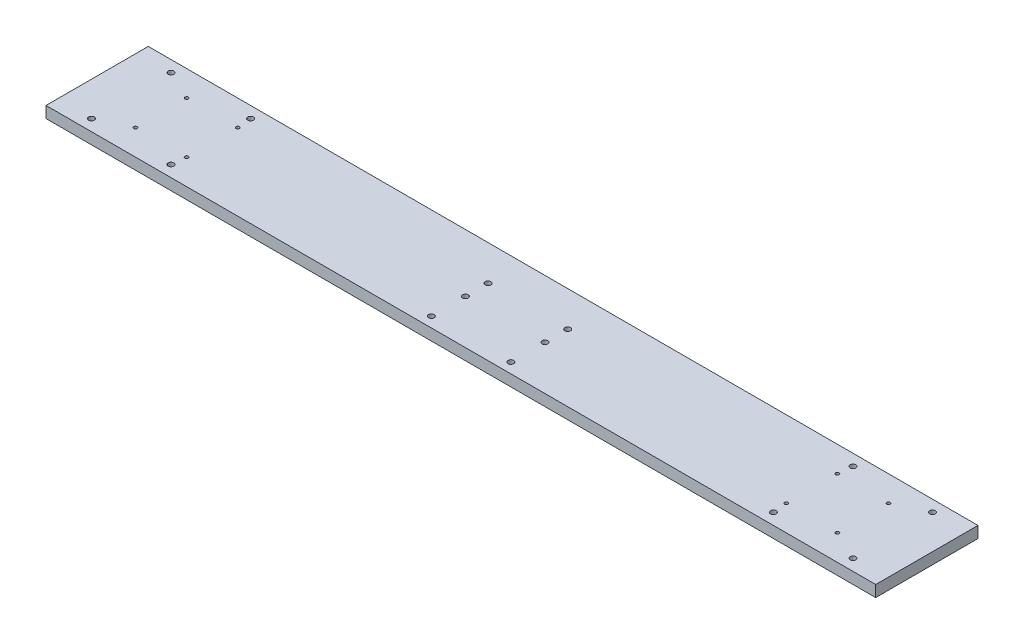
from build123d import *

# Parameters (mm, degrees)
SKETCH_1_W          = 240
SKETCH_1_H          = 90
EXTRUDE_1_DEPTH     = 4
SKETCH_2_W          = 170
SKETCH_2_H          = 90
EXTRUDE_2_DEPTH     = 6
SKETCH_4_R          = 2.5
CUT_EXTRUDE_5_DEPTH = 257.515106768
SKETCH_5_W          = 90
SKETCH_5_H          = 10
EXTRUDE_3_DEPTH     = 250
SKETCH_6_W          = 90
SKETCH_6_H          = 10
EXTRUDE_4_DEPTH     = 250
SKETCH_7_R          = 1.5
CUT_EXTRUDE_7_DEPTH = 520
SKETCH_8_R          = 3.5
CUT_EXTRUDE_8_DEPTH = 5
SKETCH_11_W         = 90
SKETCH_11_H         = 10
EXTRUDE_5_DEPTH     = 30
SKETCH_12_W         = 90
SKETCH_12_H         = 10
EXTRUDE_6_DEPTH     = 30
SKETCH_14_R         = 2.5
CUT_EXTRUDE_9_DEPTH = 30


with BuildPart() as part:
    # 草图1 → 凸台-拉伸1 (new body)
    with BuildSketch(Plane(origin=(0, 0, 0), x_dir=(1, 0, 0), z_dir=(0, 1, 0))):
        with Locations((120, -45)):
            Rectangle(SKETCH_1_W, SKETCH_1_H)
    extrude(amount=EXTRUDE_1_DEPTH)

    # 草图2 → 凸台-拉伸2 (add)
    with BuildSketch(Plane(origin=(0, 4, 0), x_dir=(1, 0, 0), z_dir=(0, 1, 0))):
        with Locations((120, -45)):
            Rectangle(SKETCH_2_W, SKETCH_2_H)
    extrude(amount=EXTRUDE_2_DEPTH)

    # 草图4 → 切除-拉伸5 (cut, through all)
    with BuildSketch(Plane.XZ):
        with Locations(Location((85, 81, 0), (0, 0, 270))):
            Circle(SKETCH_4_R)
        with Locations(Location((155, 81, 0), (0, 0, 270))):
            Circle(SKETCH_4_R)
        with Locations(Location((85, 31, 0), (0, 0, 270))):
            Circle(SKETCH_4_R)
        with Locations(Location((155, 31, 0), (0, 0, 270))):
            Circle(SKETCH_4_R)
        with Locations(Location((85, 51, 0), (0, 0, 270))):
            Circle(SKETCH_4_R)
        with Locations(Location((155, 51, 0), (0, 0, 270))):
            Circle(SKETCH_4_R)
    extrude(amount=-CUT_EXTRUDE_5_DEPTH, mode=Mode.SUBTRACT)

    # 草图5 → 凸台-拉伸3 (add)
    with BuildSketch(Plane(origin=(205, 0, 0), x_dir=(0, 0, -1), z_dir=(1, 0, 0))):
        with Locations((-45, 5)):
            Rectangle(SKETCH_5_W, SKETCH_5_H)
    extrude(amount=EXTRUDE_3_DEPTH)

    # 草图6 → 凸台-拉伸4 (add)
    with BuildSketch(Plane.ZY.offset(-35)):
        with Locations((45, 5)):
            Rectangle(SKETCH_6_W, SKETCH_6_H)
    extrude(amount=EXTRUDE_4_DEPTH)

    # 草图7 → 切除-拉伸7 (cut)
    with BuildSketch(Plane(origin=(0, 10, 0), x_dir=(1, 0, 0), z_dir=(0, 1, 0))):
        with Locations(Location((-188.76, -22.5, 0), (0, 0, 270))):
            Circle(SKETCH_7_R)
        with Locations(Location((-188.76, -67.5, 0), (0, 0, 270))):
            Circle(SKETCH_7_R)
        with Locations(Location((-143.76, -67.5, 0), (0, 0, 270))):
            Circle(SKETCH_7_R)
        with Locations(Location((-143.76, -22.5, 0), (0, 0, 270))):
            Circle(SKETCH_7_R)
        with Locations(Location((383.76, -22.5, 0), (0, 0, 270))):
            Circle(SKETCH_7_R)
        with Locations(Location((383.76, -67.5, 0), (0, 0, 270))):
            Circle(SKETCH_7_R)
        with Locations(Location((428.76, -67.5, 0), (0, 0, 270))):
            Circle(SKETCH_7_R)
        with Locations(Location((428.76, -22.5, 0), (0, 0, 270))):
            Circle(SKETCH_7_R)
    extrude(amount=-CUT_EXTRUDE_7_DEPTH, mode=Mode.SUBTRACT)

    # 草图8 → 切除-拉伸8 (cut)
    with BuildSketch(Plane.XZ):
        with Locations(Location((-188.76, 67.5, 0), (0, 0, 270))):
            Circle(SKETCH_8_R)
        with Locations(Location((-143.76, 67.5, 0), (0, 0, 270))):
            Circle(SKETCH_8_R)
        with Locations(Location((-143.76, 22.5, 0), (0, 0, 270))):
            Circle(SKETCH_8_R)
        with Locations(Location((-188.76, 22.5, 0), (0, 0, 270))):
            Circle(SKETCH_8_R)
        with Locations(Location((383.76, 67.5, 0), (0, 0, 270))):
            Circle(SKETCH_8_R)
        with Locations(Location((428.76, 67.5, 0), (0, 0, 270))):
            Circle(SKETCH_8_R)
        with Locations(Location((383.76, 22.5, 0), (0, 0, 270))):
            Circle(SKETCH_8_R)
        with Locations(Location((428.76, 22.5, 0), (0, 0, 270))):
            Circle(SKETCH_8_R)
    extrude(amount=-CUT_EXTRUDE_8_DEPTH, mode=Mode.SUBTRACT)

    # 草图11 → 凸台-拉伸5 (add)
    with BuildSketch(Plane.ZY.offset(215)):
        with Locations((45, 5)):
            Rectangle(SKETCH_11_W, SKETCH_11_H)
    extrude(amount=EXTRUDE_5_DEPTH)

    # 草图12 → 凸台-拉伸6 (add)
    with BuildSketch(Plane(origin=(455, 0, 0), x_dir=(0, 0, -1), z_dir=(1, 0, 0))):
        with Locations((-45, 5)):
            Rectangle(SKETCH_12_W, SKETCH_12_H)
    extrude(amount=EXTRUDE_6_DEPTH)

    # 草图14 → 切除-拉伸9 (cut)
    with BuildSketch(Plane(origin=(0, 10, 0), x_dir=(1, 0, 0), z_dir=(0, 1, 0))):
        with Locations(Location((-215, -10, 0), (0, 0, 270))):
            Circle(SKETCH_14_R)
        with Locations(Location((-215, -80, 0), (0, 0, 270))):
            Circle(SKETCH_14_R)
        with Locations(Location((-145, -80, 0), (0, 0, 270))):
            Circle(SKETCH_14_R)
        with Locations(Location((-145, -10, 0), (0, 0, 270))):
            Circle(SKETCH_14_R)
        with Locations(Location((385, -10, 0), (0, 0, 270))):
            Circle(SKETCH_14_R)
        with Locations(Location((385, -80, 0), (0, 0, 270))):
            Circle(SKETCH_14_R)
        with Locations(Location((455, -80, 0), (0, 0, 270))):
            Circle(SKETCH_14_R)
        with Locations(Location((455, -10, 0), (0, 0, 270))):
            Circle(SKETCH_14_R)
    extrude(amount=-CUT_EXTRUDE_9_DEPTH, mode=Mode.SUBTRACT)


solid = part.part
